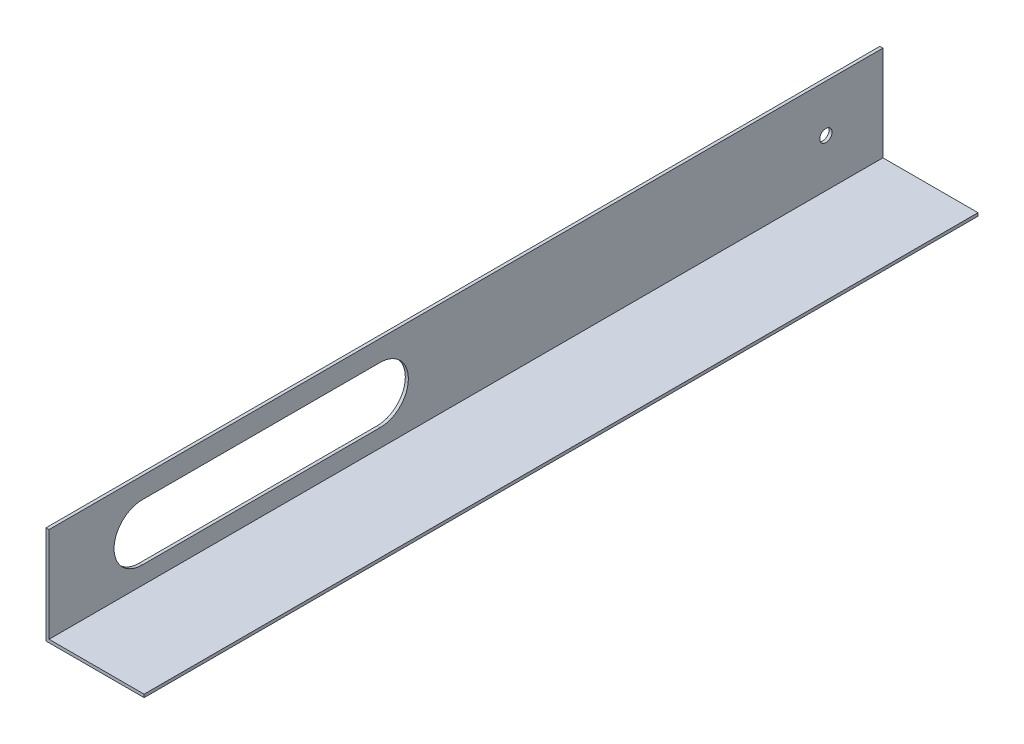
from build123d import *

# Parameters (mm, degrees)
BOSS_EXTRUDE2_DEPTH = 431.8
CUT_EXTRUDE3_DEPTH  = 127
SKETCH7_R           = 3.175
CUT_EXTRUDE4_DEPTH  = 127


with BuildPart() as part:
    # Sketch3 → Boss-Extrude2 (new body)
    with BuildSketch(Plane.XY):
        Polygon((0, 0), (0, 49.2125), (-1.5875, 49.2125), (-1.5875, -1.5875), (49.2125, -1.5875), (49.2125, 0), align=None)
    extrude(amount=BOSS_EXTRUDE2_DEPTH)

    # Sketch6 → Cut-Extrude3 (cut)
    with BuildSketch(Plane(origin=(0, 0, 0), x_dir=(0, 0, -1), z_dir=(1, 0, 0))):
        with BuildLine():
            Line((-383.54, 38.4175), (-260.35, 38.4175))
            ThreePointArc((-260.35, 38.4175), (-245.745, 23.8125), (-260.35, 9.2075))
            Line((-260.35, 9.2075), (-383.54, 9.2075))
            ThreePointArc((-383.54, 9.2075), (-398.145, 23.8125), (-383.54, 38.4175))
        make_face()
    extrude(amount=-CUT_EXTRUDE3_DEPTH, mode=Mode.SUBTRACT)

    # Sketch7 → Cut-Extrude4 (cut)
    with BuildSketch(Plane(origin=(0, 0, 0), x_dir=(0, 0, -1), z_dir=(1, 0, 0))):
        with Locations(Location((-29.538792285, 24.773594829, 0), (0, 0, 90))):
            Circle(SKETCH7_R)
    extrude(amount=-CUT_EXTRUDE4_DEPTH, mode=Mode.SUBTRACT)


solid = part.part
